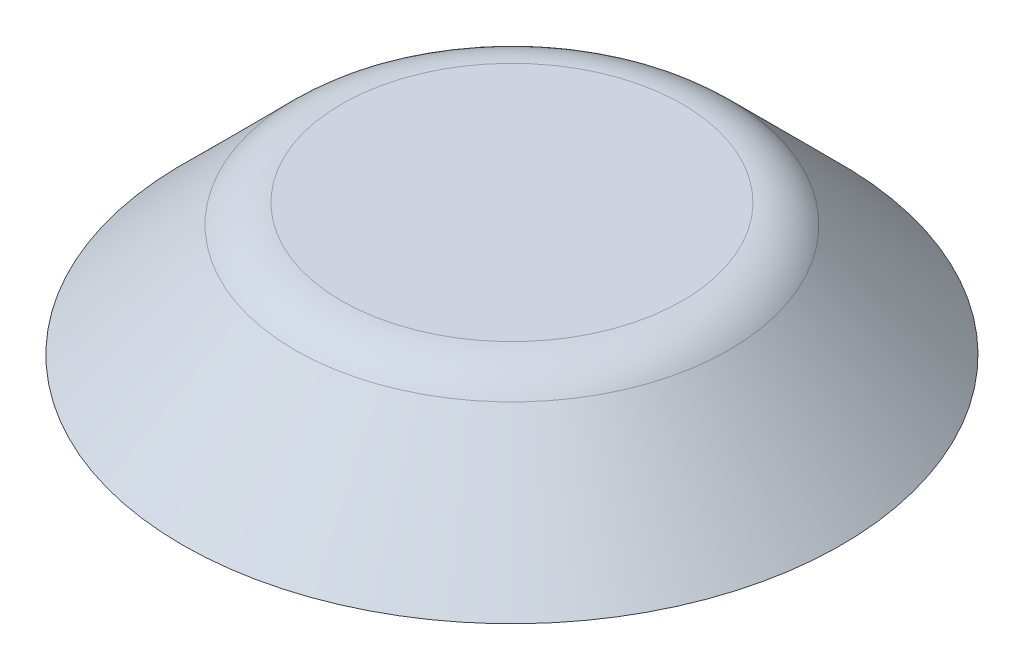
from build123d import *

# Parameters (mm, degrees)
SKETCH1_R           = 12.5
BOSS_EXTRUDE1_DEPTH = 5
BOSS_EXTRUDE1_TAPER = 45
FILLET2_R           = 2.5
SKETCH2_R           = 5
CUT_EXTRUDE1_DEPTH  = 3


with BuildPart() as part:
    # Sketch1 → Boss-Extrude1 (new body)
    with BuildSketch(Plane(origin=(0, 0, 0), x_dir=(1, 0, 0), z_dir=(0, 1, 0))):
        Circle(SKETCH1_R)
    extrude(amount=BOSS_EXTRUDE1_DEPTH, taper=BOSS_EXTRUDE1_TAPER)

    # Fillet2
    fillet2_edges = [part.edges().sort_by_distance(p)[0] for p in [
        (-7.5, 5, 0),
    ]]
    fillet(fillet2_edges, radius=FILLET2_R)

    # Sketch2 → Cut-Extrude1 (cut)
    with BuildSketch(Plane.XZ):
        with Locations(Location((0, 0, 0), (0, 0, 270))):
            Circle(SKETCH2_R)
    extrude(amount=-CUT_EXTRUDE1_DEPTH, mode=Mode.SUBTRACT)


solid = part.part
